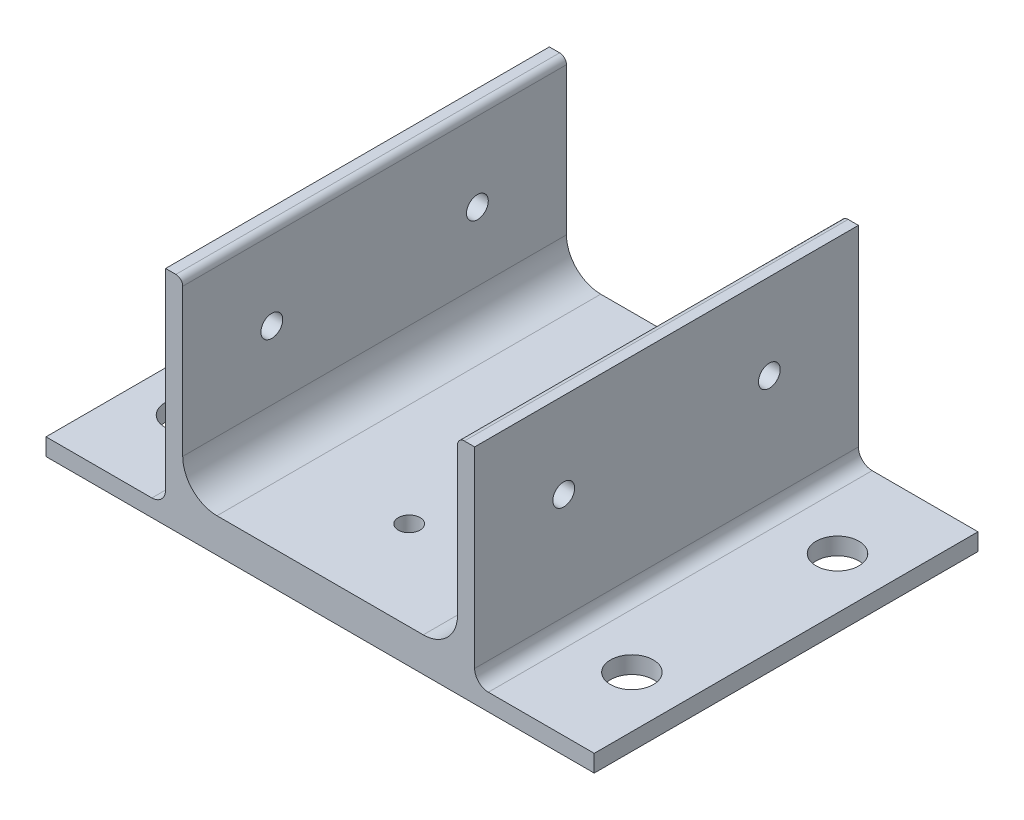
from build123d import *

# Parameters (mm, degrees)
BOSS_EXTRUDE1_DEPTH = 71.12
SKETCH4_W           = 9.4615
SKETCH4_H           = 3.175
CUT_EXTRUDE1_DEPTH  = 87.588484512
BOSS_EXTRUDE2_DEPTH = 71.12
FILLET2_R           = 6.35
FILLET4_R           = 1.27
SKETCH6_W           = 101.6
SKETCH6_H           = 71.12
BOSS_EXTRUDE3_DEPTH = 3.175
SKETCH7_R           = 2.0193
CUT_EXTRUDE2_DEPTH  = 113.19752808
SKETCH8_R           = 2.0193
CUT_EXTRUDE3_DEPTH  = 113.150797845
SKETCH9_R           = 3.96875
CUT_EXTRUDE4_DEPTH  = 113.150797845
FILLET5_R           = 2.54
SKETCH10_R          = 5.08
CUT_EXTRUDE5_DEPTH  = 3.175


with BuildPart() as part:
    # Sketch3 → Boss-Extrude1 (new body)
    with BuildSketch(Plane.XY):
        with BuildLine():
            Line((0, 6.35), (0, 33.655))
            ThreePointArc((0, 33.655), (-0.371974388, 34.553025612), (-1.27, 34.925))
            Line((-1.27, 34.925), (-3.175, 34.925))
            Line((-3.175, 34.925), (-3.175, 0))
            Line((-3.175, 0), (-3.175, -3.175))
            Line((-3.175, -3.175), (34.925, -3.175))
            Line((34.925, -3.175), (34.925, -1.27))
            ThreePointArc((34.925, -1.27), (34.553025612, -0.371974388), (33.655, 0))
            Line((33.655, 0), (6.35, 0))
            ThreePointArc((6.35, 0), (1.859871939, 1.859871939), (0, 6.35))
        make_face()
    extrude(amount=BOSS_EXTRUDE1_DEPTH)

    # Sketch4 → Cut-Extrude1 (cut, through all)
    with BuildSketch(Plane(origin=(0, 0, 0), x_dir=(-1, 0, 0), z_dir=(0, 0, -1))):
        with Locations((-30.19425, -1.5875)):
            Rectangle(SKETCH4_W, SKETCH4_H)
    extrude(amount=-CUT_EXTRUDE1_DEPTH, mode=Mode.SUBTRACT)

    # Sketch5 → Boss-Extrude2 (add)
    with BuildSketch(Plane(origin=(0, 0, 0), x_dir=(-1, 0, 0), z_dir=(0, 0, -1))):
        Polygon((-25.4635, -3.175), (-54.102, -3.175), (-54.102, 34.925), (-50.927, 34.925), (-50.927, 0), (-25.4635, 0), align=None)
    extrude(amount=-BOSS_EXTRUDE2_DEPTH)

    # Fillet2
    fillet2_edges = [part.edges().sort_by_distance(p)[0] for p in [
        (50.927, 0, 35.56),
    ]]
    fillet(fillet2_edges, radius=FILLET2_R)

    # Fillet4
    fillet4_edges = [part.edges().sort_by_distance(p)[0] for p in [
        (50.927, 34.925, 35.56),
    ]]
    fillet(fillet4_edges, radius=FILLET4_R)

    # Sketch6 → Boss-Extrude3 (add)
    with BuildSketch(Plane.XZ.offset(3.175)):
        with Locations((25.4635, 35.56)):
            Rectangle(SKETCH6_W, SKETCH6_H)
    extrude(amount=BOSS_EXTRUDE3_DEPTH)

    # Sketch7 → Cut-Extrude2 (cut, through all)
    with BuildSketch(Plane.ZY.offset(3.175)):
        with Locations(Location((16.51, 19.05, 0), (0, 0, 270))):
            Circle(SKETCH7_R)
        with Locations(Location((54.61, 19.05, 0), (0, 0, 270))):
            Circle(SKETCH7_R)
    extrude(amount=-CUT_EXTRUDE2_DEPTH, mode=Mode.SUBTRACT)

    # Sketch8 → Cut-Extrude3 (cut, through all)
    with BuildSketch(Plane.XZ.offset(6.35)):
        with Locations((25.4635, 16.51)):
            Circle(SKETCH8_R)
        with Locations((25.4635, 54.61)):
            Circle(SKETCH8_R)
    extrude(amount=-CUT_EXTRUDE3_DEPTH, mode=Mode.SUBTRACT)

    # Sketch9 → Cut-Extrude4 (cut, through all)
    with BuildSketch(Plane.XZ.offset(6.35)):
        with Locations((-15.8115, 16.51)):
            Circle(SKETCH9_R)
        with Locations((-15.8115, 54.61)):
            Circle(SKETCH9_R)
        with Locations((66.7385, 54.61)):
            Circle(SKETCH9_R)
        with Locations((66.7385, 16.51)):
            Circle(SKETCH9_R)
    extrude(amount=-CUT_EXTRUDE4_DEPTH, mode=Mode.SUBTRACT)

    # Fillet5
    fillet5_edges = [part.edges().sort_by_distance(p)[0] for p in [
        (-3.175, -3.175, 35.56),
        (54.102, -3.175, 35.56),
    ]]
    fillet(fillet5_edges, radius=FILLET5_R)

    # Sketch10 → Cut-Extrude5 (cut)
    with BuildSketch(Plane.XZ.offset(6.35)):
        with Locations((25.4635, 54.61)):
            Circle(SKETCH10_R)
        with Locations((25.4635, 16.51)):
            Circle(SKETCH10_R)
    extrude(amount=-CUT_EXTRUDE5_DEPTH, mode=Mode.SUBTRACT)


solid = part.part
